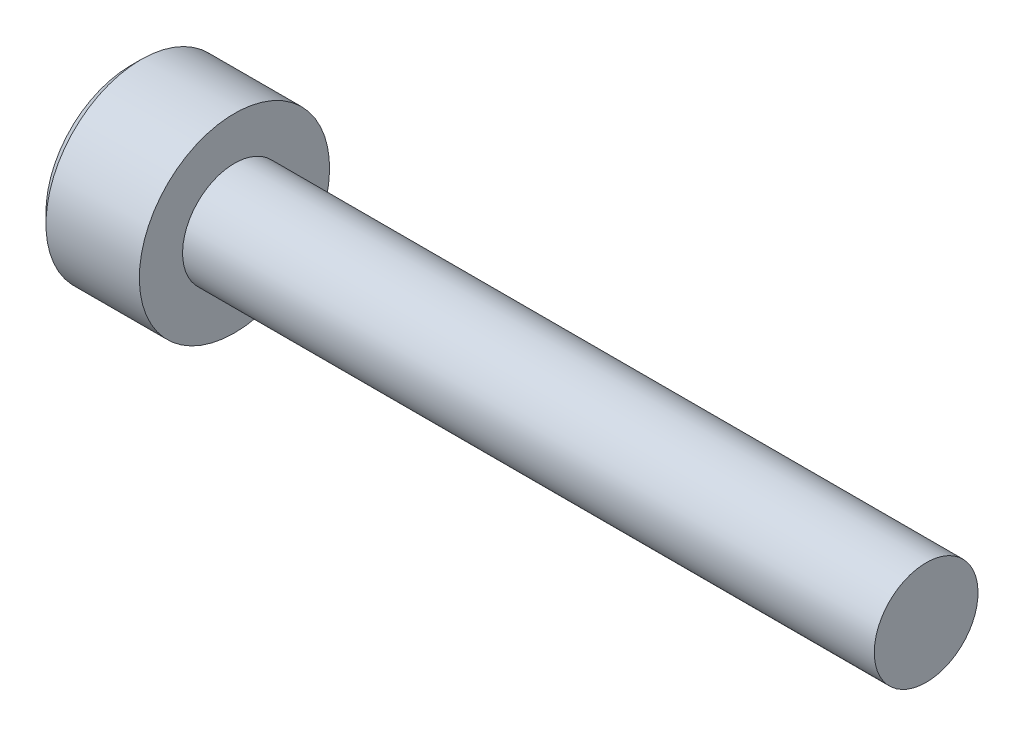
from build123d import *

# Parameters (mm, degrees)
CHAMFER1_SIZE      = 0.3
CUT_EXTRUDE1_DEPTH = 1.3


with BuildPart() as part:
    # Sketch1 → Revolve1 (revolve)
    with BuildSketch(Plane.XY, mode=Mode.PRIVATE) as revolve1_sk:
        Polygon((0, 1.5), (20, 1.5), (20, 0), (-3, 0), (-3, 2.75), (0, 2.75), align=None)
    revolve(revolve1_sk.sketch.rotate(Axis((-3, 0, 0), (1, 0, 0)), 180), axis=Axis((-3, 0, 0), (1, 0, 0)))

    # Chamfer1
    chamfer1_edges = [part.edges().sort_by_distance(p)[0] for p in [
        (-3, 2.75, 0),
    ]]
    chamfer(chamfer1_edges, length=CHAMFER1_SIZE)

    # Sketch2 → Cut-Revolve1 (revolve, cut)
    with BuildSketch(Plane.XY, mode=Mode.PRIVATE) as cut_revolve1_sk:
        Polygon((-0.948924226, 0), (-1.7, 1.25), (-3, 1.25), (-3, 0), align=None)
    revolve(cut_revolve1_sk.sketch.rotate(Axis((-3, 0, 0), (1, 0, 0)), 180), axis=Axis((-3, 0, 0), (1, 0, 0)), mode=Mode.SUBTRACT)

    # Sketch3 → Cut-Extrude1 (cut)
    with BuildSketch(Plane.ZY.offset(3)):
        Polygon((1.25, 0.721687836), (0, 1.443375673), (-1.25, 0.721687836), (-1.25, -0.721687836), (0, -1.443375673), (1.25, -0.721687836), align=None)
    extrude(amount=-CUT_EXTRUDE1_DEPTH, mode=Mode.SUBTRACT)


solid = part.part
